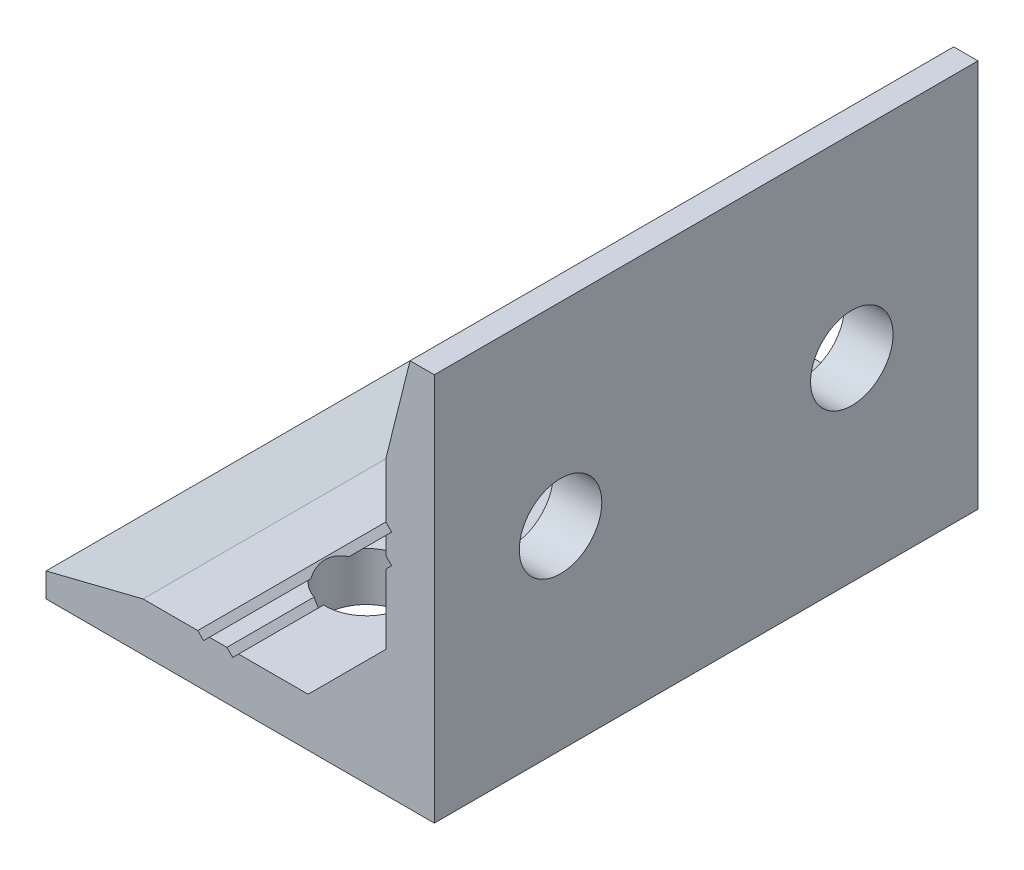
from build123d import *

# Parameters (mm, degrees)
EXTRUDE_1_DEPTH     = 28
SKETCH_3_R          = 4.25
CUT_EXTRUDE_1_DEPTH = 61.074953184


with BuildPart() as part:
    # 草图1 → 凸台-拉伸1 (new, symmetric)
    with BuildSketch(Plane.XY):
        Polygon((0, 0), (40, 0), (40, 40), (37.5, 40), (35, 30), (35, 24.364950833), (35.6, 23.764950833), (35, 23.164950833), (35, 21.364950833), (35.6, 20.764950833), (35, 20.164950833), (35, 13), (27, 5), (19.835049167, 5), (19.235049167, 4.4), (18.635049167, 5), (16.835049167, 5), (16.235049167, 4.4), (15.635049167, 5), (10, 5), (0, 2.5), align=None)
    extrude(amount=EXTRUDE_1_DEPTH, both=True)

    # 草图3 → 切除-拉伸1 (cut, through all)
    with BuildSketch(Plane(origin=(0, 5, 0), x_dir=(1, 0, 0), z_dir=(0, 1, 0))):
        with Locations(Location((20, 15, 0), (0, 0, 270))):
            Circle(SKETCH_3_R)
        with Locations(Location((20, -15, 0), (0, 0, 267.775679771))):
            Circle(SKETCH_3_R)
    cut_extrude_1 = extrude(amount=-CUT_EXTRUDE_1_DEPTH, mode=Mode.SUBTRACT)

    # 镜向1: 切除-拉伸1 across plane
    add(cut_extrude_1.mirror(Plane(origin=(20, 20, 0), x_dir=(0, 0, 1), z_dir=(-0.7071067811865414, -0.7071067811865538, 0))), mode=Mode.SUBTRACT)


solid = part.part
